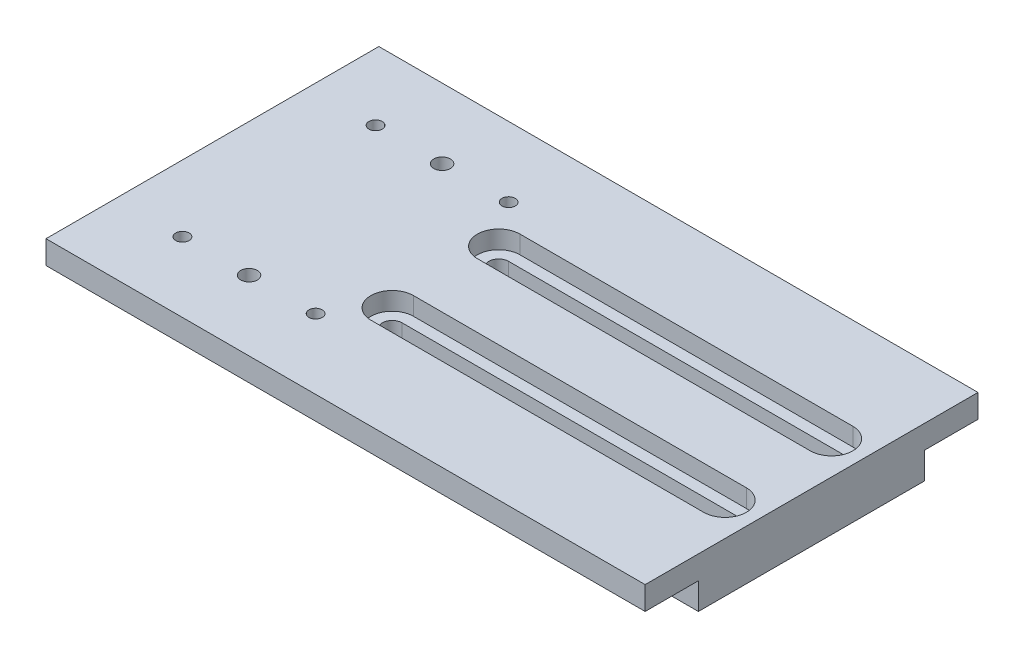
from build123d import *

# Parameters (mm, degrees)
SKIZZE1_W                       = 90
SKIZZE1_H                       = 50
AUFSATZ_LINEAR_AUSTRAGEN1_DEPTH = 7.5
SKIZZE2_R                       = 1
SCHNITT_LINEAR_AUSTRAGEN1_DEPTH = 53.021630117
SCHNITT_LINEAR_AUSTRAGEN2_DEPTH = 2.7
SKIZZE6_W                       = 13
SKIZZE6_H                       = 4
SCHNITT_LINEAR_AUSTRAGEN5_DEPTH = 94.70832407
M3_GEWINDEBOHRUNG1_D            = 2.5


with BuildPart() as part:
    # Skizze1 → Aufsatz-Linear austragen1 (new body)
    with BuildSketch(Plane(origin=(0, 0, 0), x_dir=(1, 0, 0), z_dir=(0, 1, 0))):
        Rectangle(SKIZZE1_W, SKIZZE1_H)
    extrude(amount=AUFSATZ_LINEAR_AUSTRAGEN1_DEPTH)

    # Skizze2 → Schnitt-Linear austragen1 (cut, through all)
    with BuildSketch(Plane(origin=(0, 7.5, 0), x_dir=(1, 0, 0), z_dir=(0, 1, 0))):
        with Locations(Location((-35, 14.5, 0), (0, 0, 270))):
            Circle(SKIZZE2_R)
        with Locations(Location((-15, 14.5, 0), (0, 0, 270))):
            Circle(SKIZZE2_R)
        with Locations(Location((-35, -14.5, 0), (0, 0, 90))):
            Circle(SKIZZE2_R)
        with Locations(Location((-15, -14.5, 0), (0, 0, 90))):
            Circle(SKIZZE2_R)
        with BuildLine():
            Line((-10, 9.5), (40, 9.5))
            ThreePointArc((40, 9.5), (41.5, 8), (40, 6.5))
            Line((40, 6.5), (-10, 6.5))
            ThreePointArc((-10, 6.5), (-11.5, 8), (-10, 9.5))
        make_face()
        with BuildLine():
            Line((-10, -9.5), (40, -9.5))
            ThreePointArc((40, -9.5), (41.5, -8), (40, -6.5))
            Line((40, -6.5), (-10, -6.5))
            ThreePointArc((-10, -6.5), (-11.5, -8), (-10, -9.5))
        make_face()
    extrude(amount=-SCHNITT_LINEAR_AUSTRAGEN1_DEPTH, mode=Mode.SUBTRACT)

    # Skizze3 → Schnitt-Linear austragen2 (cut)
    with BuildSketch(Plane(origin=(0, 7.5, 0), x_dir=(1, 0, 0), z_dir=(0, 1, 0))):
        with BuildLine():
            Line((-10, 11.2), (40, 11.2))
            ThreePointArc((40, 11.2), (43.2, 8), (40, 4.8))
            Line((40, 4.8), (-10, 4.8))
            ThreePointArc((-10, 4.8), (-13.2, 8), (-10, 11.2))
        make_face()
        with BuildLine():
            Line((-10, -11.2), (40, -11.2))
            ThreePointArc((40, -11.2), (43.2, -8), (40, -4.8))
            Line((40, -4.8), (-10, -4.8))
            ThreePointArc((-10, -4.8), (-13.2, -8), (-10, -11.2))
        make_face()
    extrude(amount=-SCHNITT_LINEAR_AUSTRAGEN2_DEPTH, mode=Mode.SUBTRACT)

    # Skizze6 → Schnitt-Linear austragen5 (cut, through all)
    with BuildSketch(Plane.ZY.offset(45)):
        with Locations((-23.5, 2)):
            Rectangle(SKIZZE6_W, SKIZZE6_H)
        with Locations((23.5, 2)):
            Rectangle(SKIZZE6_W, SKIZZE6_H)
    extrude(amount=-SCHNITT_LINEAR_AUSTRAGEN5_DEPTH, mode=Mode.SUBTRACT)

    # M3 Gewindebohrung1 (through all)
    with Locations(Plane(origin=(0, 7.5, 0), x_dir=(1, 0, 0), z_dir=(0, 1, 0))):
        with Locations((-25, 14.5), (-25, -14.5)):
            Hole(M3_GEWINDEBOHRUNG1_D / 2)


solid = part.part
